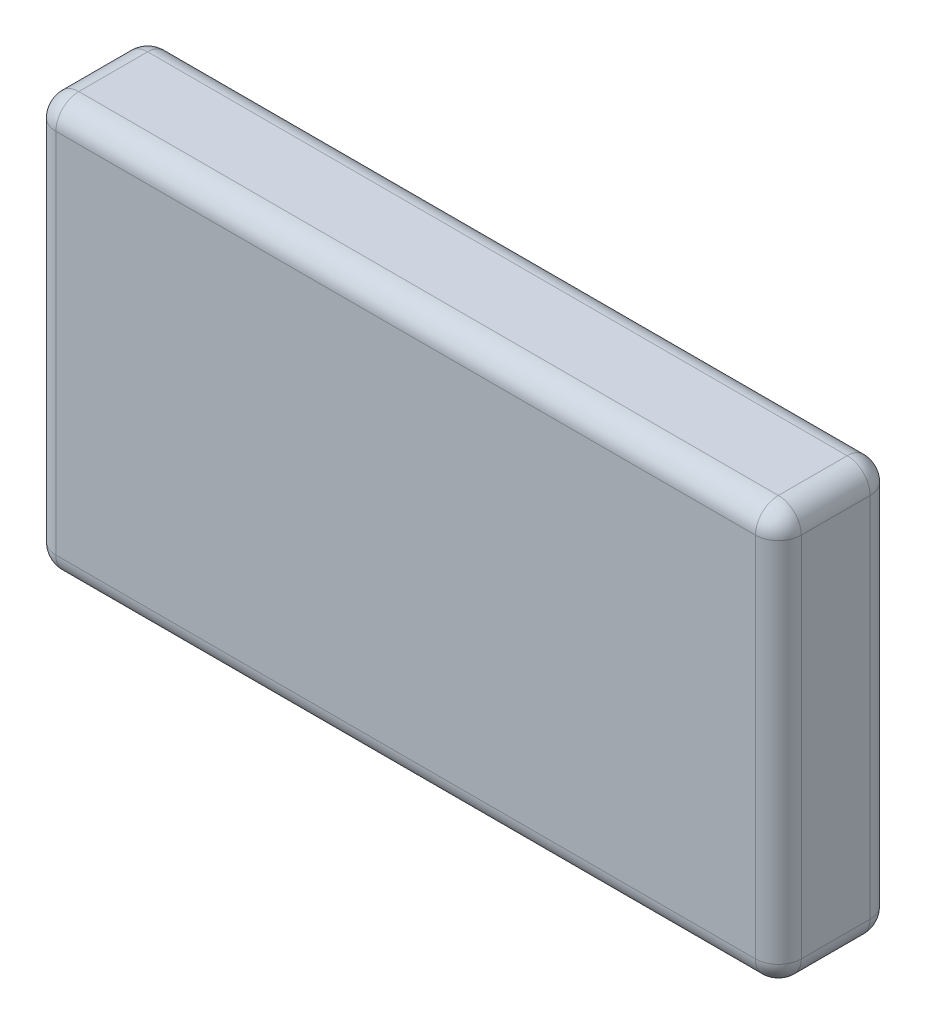
from build123d import *

# Parameters (mm, degrees)
SKETCH_1_W      = 65
SKETCH_1_H      = 36
EXTRUDE_1_DEPTH = 10
FILLET_1_R      = 2


with BuildPart() as part:
    # Эскиз1 → Бобышка-Вытянуть1 (new body)
    with BuildSketch(Plane.XY):
        with Locations((32.5, 18)):
            Rectangle(SKETCH_1_W, SKETCH_1_H)
    extrude(amount=EXTRUDE_1_DEPTH)

    # Скругление1
    fillet_1_edges = [part.edges().sort_by_distance(p)[0] for p in [
        (65, 18, 10),
        (32.5, 36, 10),
        (0, 18, 10),
        (32.5, 36, 0),
        (65, 18, 0),
        (32.5, 0, 0),
        (0, 18, 0),
        (0, 36, 5),
        (65, 36, 5),
        (65, 0, 5),
        (0, 0, 5),
        (32.5, 0, 10),
    ]]
    fillet(fillet_1_edges, radius=FILLET_1_R)


solid = part.part
